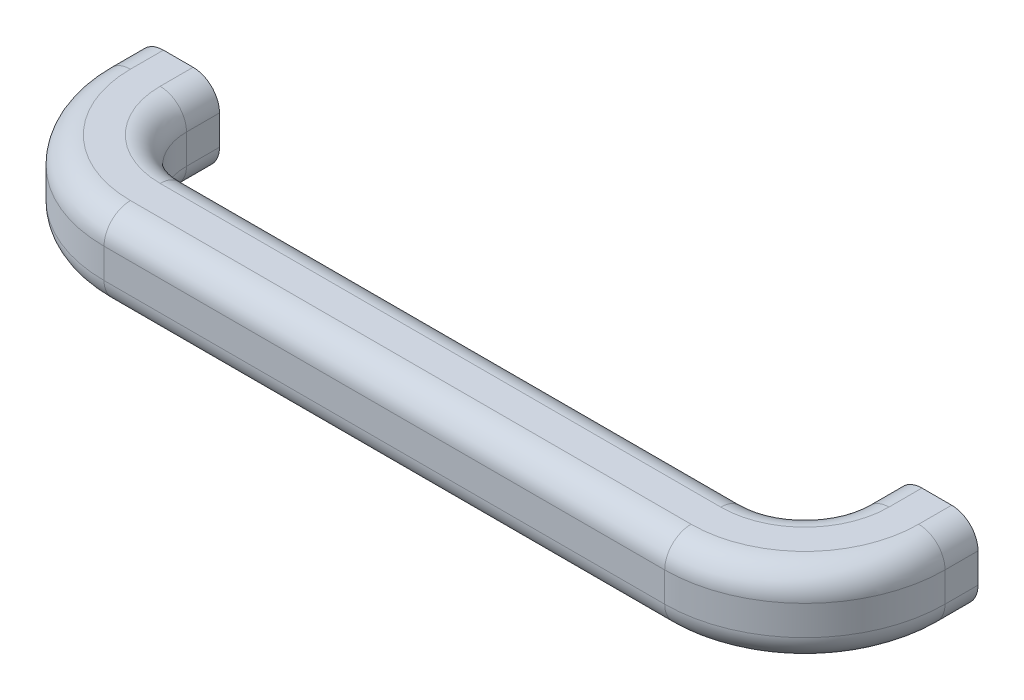
from build123d import *

# Parameters (mm, degrees)
SKETCH11_W         = 485.793761844
SKETCH11_H         = 595.960227968
CUT_EXTRUDE1_DEPTH = 276.332207476


with BuildPart() as part:
    # Sweep-Thin1: sweep along a path in Sketch2
    with BuildLine(Plane(origin=(0, 0, 0), x_dir=(1, 0, 0), z_dir=(0, 1, 0))) as sweep_thin1_path:
        Line((0, 169.789538956), (0, 157.289538956))
        Line((0, 157.289538956), (0, 30))
        ThreePointArc((0, 30), (-8.786796564, 8.786796564), (-30, 0))
        Line((-30, 0), (-200, 0))
        ThreePointArc((-200, 0), (-221.213203436, 8.786796564), (-230, 30))
        Line((-230, 30), (-230, 40))
    # Sketch6 → Sweep-Thin1 (sweep)
    with BuildSketch(Plane.XY.offset(-40)):
        with BuildLine():
            Line((-225.5, 12.5), (-234.5, 12.5))
            ThreePointArc((-234.5, 12.5), (-240.156854249, 10.156854249), (-242.5, 4.5))
            Line((-242.5, 4.5), (-242.5, -4.5))
            ThreePointArc((-242.5, -4.5), (-240.156854249, -10.156854249), (-234.5, -12.5))
            Line((-234.5, -12.5), (-225.5, -12.5))
            ThreePointArc((-225.5, -12.5), (-219.843145751, -10.156854249), (-217.5, -4.5))
            Line((-217.5, -4.5), (-217.5, 4.5))
            ThreePointArc((-217.5, 4.5), (-219.843145751, 10.156854249), (-225.5, 12.5))
        make_face()
        with BuildLine():
            Line((-225.5, 9.5), (-234.5, 9.5))
            ThreePointArc((-234.5, 9.5), (-238.035533906, 8.035533906), (-239.5, 4.5))
            Line((-239.5, 4.5), (-239.5, -4.5))
            ThreePointArc((-239.5, -4.5), (-238.035533906, -8.035533906), (-234.5, -9.5))
            Line((-234.5, -9.5), (-225.5, -9.5))
            ThreePointArc((-225.5, -9.5), (-221.964466094, -8.035533906), (-220.5, -4.5))
            Line((-220.5, -4.5), (-220.5, 4.5))
            ThreePointArc((-220.5, 4.5), (-221.964466094, 8.035533906), (-225.5, 9.5))
        make_face(mode=Mode.SUBTRACT)
    sweep(path=sweep_thin1_path.line)

    # Sketch11 → Cut-Extrude1 (cut, through all)
    with BuildSketch(Plane.XY.offset(-40)):
        with Locations((212.093031721, 3.359547151)):
            Rectangle(SKETCH11_W, SKETCH11_H)
    extrude(amount=-CUT_EXTRUDE1_DEPTH, mode=Mode.SUBTRACT)


solid = part.part
